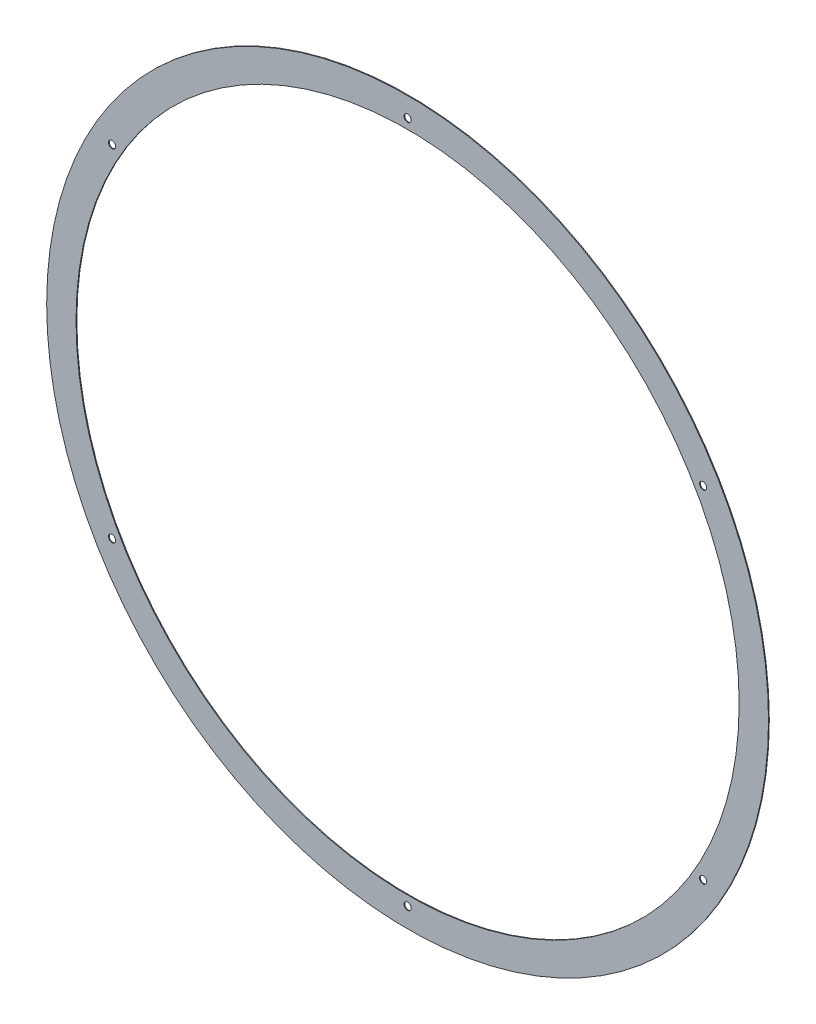
from build123d import *

# Parameters (mm, degrees)
SKETCH1_R           = 114.3
SKETCH1_R_2         = 1.1303
SKETCH1_R_3         = 105
BOSS_EXTRUDE1_DEPTH = 0.254


with BuildPart() as part:
    # Sketch1 → Boss-Extrude1 (new body)
    with BuildSketch(Plane.XY):
        with Locations((-20.073709177, -8.103148659)):
            Circle(SKETCH1_R)
        with Locations((-113.658579374, -62.134398659)):
            Circle(SKETCH1_R_2, mode=Mode.SUBTRACT)
        with Locations((-20.073709177, -116.165648659)):
            Circle(SKETCH1_R_2, mode=Mode.SUBTRACT)
        with Locations((73.511161019, -62.134398659)):
            Circle(SKETCH1_R_2, mode=Mode.SUBTRACT)
        with Locations((73.511161019, 45.928101341)):
            Circle(SKETCH1_R_2, mode=Mode.SUBTRACT)
        with Locations((-20.073709177, 99.959351341)):
            Circle(SKETCH1_R_2, mode=Mode.SUBTRACT)
        with Locations((-20.073709177, -8.103148659)):
            Circle(SKETCH1_R_3, mode=Mode.SUBTRACT)
        with Locations((-113.658579374, 45.928101341)):
            Circle(SKETCH1_R_2, mode=Mode.SUBTRACT)
    extrude(amount=BOSS_EXTRUDE1_DEPTH)


solid = part.part
